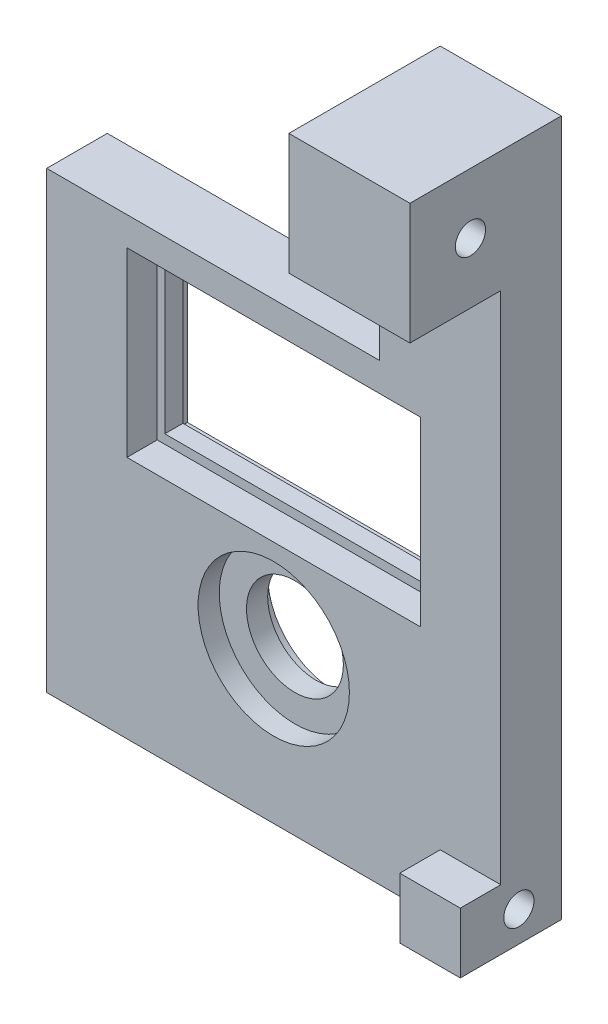
from build123d import *

# Parameters (mm, degrees)
SKETCH_1_W                      = 75
SKETCH_1_H                      = 115
EXTRUDE_1_DEPTH                 = 10
CUT_EXTRUDE_1_REACH             = 71.372
SKETCH_2_R                      = 8
SKETCH_3_R                      = 12.5
CUT_EXTRUDE_2_DEPTH             = 3.5
SKETCH_4_R                      = 11
CUT_EXTRUDE_3_DEPTH             = 3
SKETCH_6_W                      = 20
SKETCH_6_H                      = 20
EXTRUDE_2_DEPTH                 = 15
SKETCH_7_W                      = 6.681785618
SKETCH_7_H                      = 10
EXTRUDE_3_DEPTH                 = 10
CUT_EXTRUDE_4_REACH             = 75.058
SKETCH_8_W                      = 55
SKETCH_8_H                      = 40
CUT_EXTRUDE_4_DIRECTION_2_DEPTH = 74.058195981
CUT_EXTRUDE_5_REACH             = 75.058
SKETCH_9_W                      = 46
SKETCH_9_H                      = 27
SKETCH_10_W                     = 48.5
SKETCH_10_H                     = 30
CUT_EXTRUDE_6_DEPTH             = 2
SKETCH_11_W                     = 48.5
SKETCH_11_H                     = 30
CUT_EXTRUDE_7_DEPTH             = 5
SKETCH_12_R                     = 2.5
CUT_EXTRUDE_8_DEPTH             = 15


with BuildPart() as part:
    # 草图1 → 凸台-拉伸1 (new body)
    with BuildSketch(Plane.XY):
        Rectangle(SKETCH_1_W, SKETCH_1_H)
    extrude(amount=EXTRUDE_1_DEPTH)

    # 草图2 → 切除-拉伸1 (cut, up to next)
    with BuildSketch(Plane.XY.offset(10), mode=Mode.PRIVATE) as cut_extrude_1_sk1:
        with Locations((0, -32.5)):
            Circle(SKETCH_2_R)
    cut_extrude_1_tool1 = extrude(cut_extrude_1_sk1.sketch, amount=-CUT_EXTRUDE_1_REACH, mode=Mode.PRIVATE) & part.part
    add(cut_extrude_1_tool1.solids().sort_by_distance((0, -32.5, 10))[0], mode=Mode.SUBTRACT)

    # 草图3 → 切除-拉伸2 (cut)
    with BuildSketch(Plane.XY.offset(10)):
        with Locations((0, -32.5)):
            Circle(SKETCH_3_R)
    extrude(amount=-CUT_EXTRUDE_2_DEPTH, mode=Mode.SUBTRACT)

    # 草图4 → 切除-拉伸3 (cut)
    with BuildSketch(Plane(origin=(0, 0, 0), x_dir=(-1, 0, 0), z_dir=(0, 0, -1))):
        with Locations((0, -32.5)):
            Circle(SKETCH_4_R)
    extrude(amount=-CUT_EXTRUDE_3_DEPTH, mode=Mode.SUBTRACT)

    # 草图6 → 凸台-拉伸2 (add)
    with BuildSketch(Plane.XY.offset(10)):
        with Locations((27.5, 47.5)):
            Rectangle(SKETCH_6_W, SKETCH_6_H)
    extrude(amount=EXTRUDE_2_DEPTH)

    # 草图7 → 凸台-拉伸3 (add)
    with BuildSketch(Plane(origin=(37.5, 0, 0), x_dir=(0, 0, -1), z_dir=(1, 0, 0))):
        with Locations((-13.340892809, -52.5)):
            Rectangle(SKETCH_7_W, SKETCH_7_H)
    extrude(amount=-EXTRUDE_3_DEPTH)

    # 草图8 → 切除-拉伸4 (cut, up to next)
    with BuildSketch(Plane(origin=(0, 0, 0), x_dir=(-1, 0, 0), z_dir=(0, 0, -1)), mode=Mode.PRIVATE) as cut_extrude_4_sk1:
        with Locations((10, 37.5)):
            Rectangle(SKETCH_8_W, SKETCH_8_H)
    cut_extrude_4_tool1 = extrude(cut_extrude_4_sk1.sketch, amount=-CUT_EXTRUDE_4_REACH, mode=Mode.PRIVATE) & part.part
    add(cut_extrude_4_tool1.solids().sort_by_distance((-10, 37.5, 0))[0], mode=Mode.SUBTRACT)

    # 草图8 → 切除-拉伸4 direction 2 (cut)
    with BuildSketch(Plane(origin=(0, 0, 0), x_dir=(-1, 0, 0), z_dir=(0, 0, -1))):
        with Locations((10, 37.5)):
            Rectangle(SKETCH_8_W, SKETCH_8_H)
    extrude(amount=CUT_EXTRUDE_4_DIRECTION_2_DEPTH, mode=Mode.SUBTRACT)

    # 草图9 → 切除-拉伸5 (cut, up to next)
    with BuildSketch(Plane(origin=(0, 0, 0), x_dir=(-1, 0, 0), z_dir=(0, 0, -1)), mode=Mode.PRIVATE) as cut_extrude_5_sk1:
        with Locations((0, -2.234079676)):
            Rectangle(SKETCH_9_W, SKETCH_9_H)
    cut_extrude_5_tool1 = extrude(cut_extrude_5_sk1.sketch, amount=-CUT_EXTRUDE_5_REACH, mode=Mode.PRIVATE) & part.part
    add(cut_extrude_5_tool1.solids().sort_by_distance((0, -2.23408, 0))[0], mode=Mode.SUBTRACT)

    # 草图10 → 切除-拉伸6 (cut)
    with BuildSketch(Plane(origin=(0, 0, 0), x_dir=(-1, 0, 0), z_dir=(0, 0, -1))):
        with Locations((0, -2.234079676)):
            Rectangle(SKETCH_10_W, SKETCH_10_H)
    extrude(amount=-CUT_EXTRUDE_6_DEPTH, mode=Mode.SUBTRACT)

    # 草图11 → 切除-拉伸7 (cut)
    with BuildSketch(Plane.XY.offset(10)):
        with Locations((0, -2.234079676)):
            Rectangle(SKETCH_11_W, SKETCH_11_H)
    extrude(amount=-CUT_EXTRUDE_7_DEPTH, mode=Mode.SUBTRACT)

    # 草图12 → 切除-拉伸8 (cut)
    with BuildSketch(Plane(origin=(37.5, 0, 0), x_dir=(0, 0, -1), z_dir=(1, 0, 0))):
        with Locations((-15, 47.5)):
            Circle(SKETCH_12_R)
        with Locations((-7, -52.5)):
            Circle(SKETCH_12_R)
    extrude(amount=-CUT_EXTRUDE_8_DEPTH, mode=Mode.SUBTRACT)


solid = part.part
